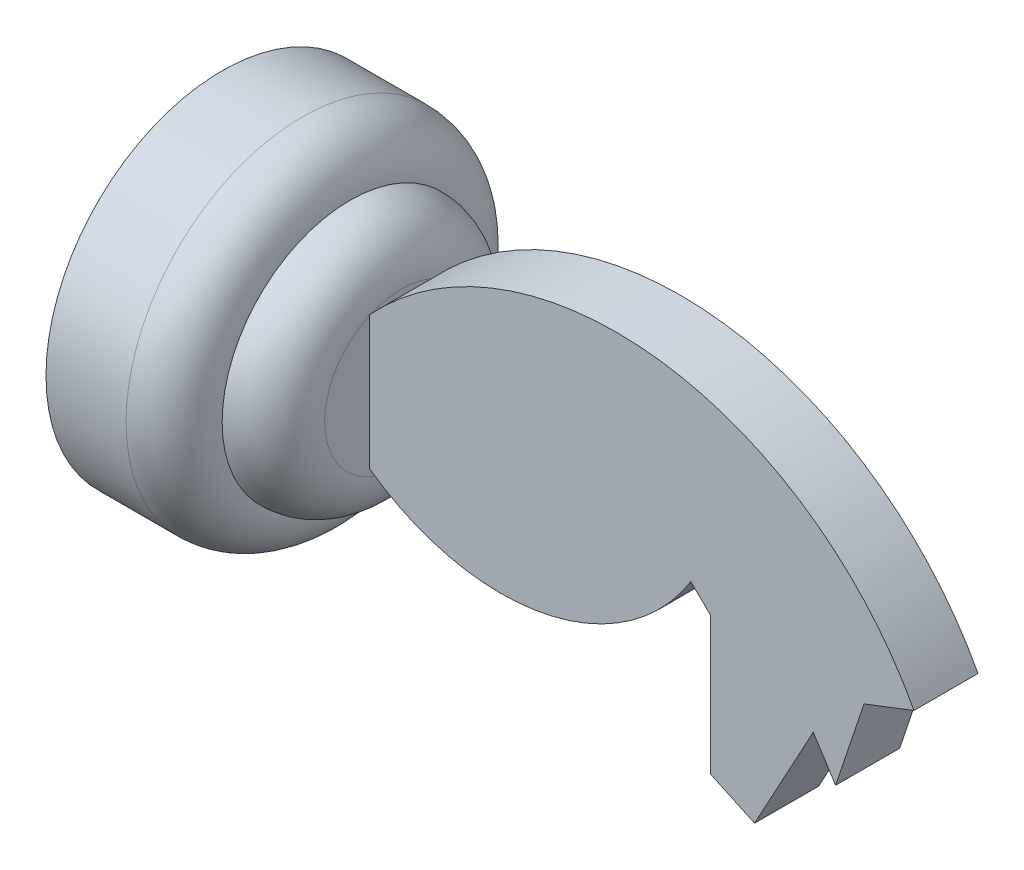
from build123d import *

# Parameters (mm, degrees)
EXTRUDE_1931_DEPTH = 2


with BuildPart() as part:
    # Sketch 231 → Повернуть1 (revolve)
    with BuildSketch(Plane.XY):
        with BuildLine():
            Line((0, 11), (0, 0))
            Line((0, 0), (1, 0))
            Line((1, 0), (1, 5.25))
            Line((1, 5.25), (3.5, 5.25))
            Line((3.5, 5.25), (3.5, 0))
            Line((3.5, 0), (11.2, 0))
            Line((11.2, 0), (11.2, 4.8))
            ThreePointArc((11.2, 4.8), (10.2627417, 7.0627417), (8, 8))
            ThreePointArc((8, 8), (7.121320344, 10.121320344), (5, 11))
            Line((5, 11), (0, 11))
        make_face()
    revolve(axis=Axis((0, 0, 0), (1, 0, 0)))

    # Sketch 913 → Extrude 1931 (add, symmetric)
    with BuildSketch(Plane.XY):
        with BuildLine():
            Line((11.2, 4.4), (11.2, -3.914978255))
            ThreePointArc((11.2, -3.914978255), (22.080678837, -6.30816882), (31.263463773, 0))
            Line((31.263463773, 0), (32.498964702, -1.197255299))
            Line((32.498964702, -1.197255299), (32.498964702, -9.797255299))
            Line((32.498964702, -9.797255299), (35.248695767, -11.07))
            Line((35.248695767, -11.07), (38.912013935, -4.32))
            Line((38.912013935, -4.32), (40.307542508, -6.49))
            Line((40.307542508, -6.49), (42.083014277, -1.2))
            Line((42.083014277, -1.2), (45.2, 0))
            ThreePointArc((45.2, 0), (29.338267199, 10.995701086), (11.2, 4.4))
        make_face()
    extrude(amount=EXTRUDE_1931_DEPTH, both=True)


solid = part.part
